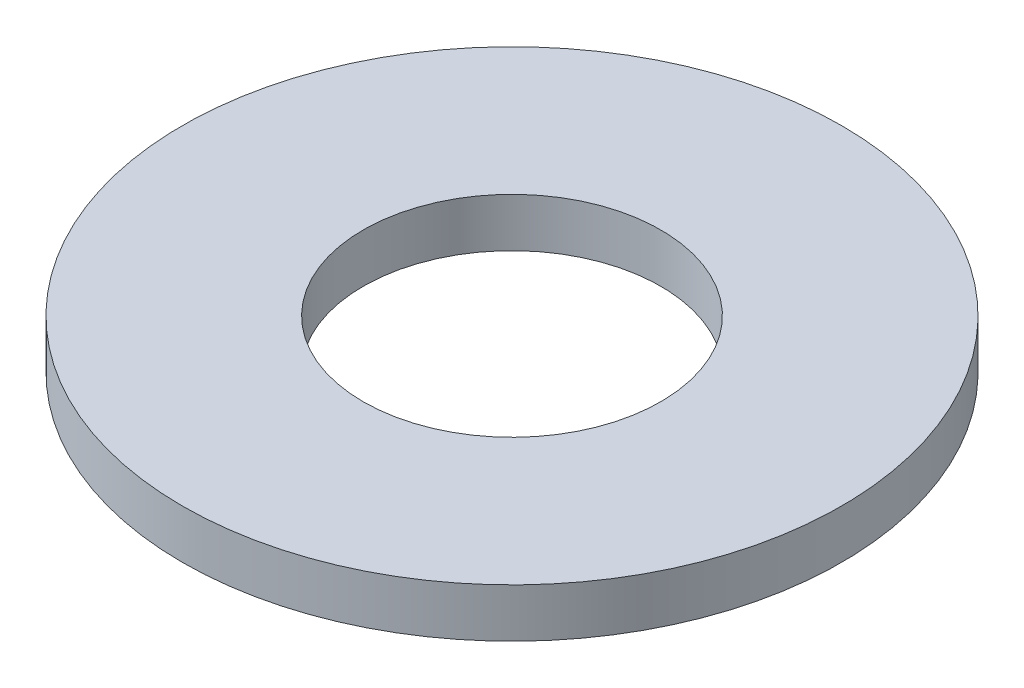
from build123d import *

# Parameters (mm, degrees)
SKETCH1_R           = 3.375
SKETCH1_R_2         = 1.524
BOSS_EXTRUDE1_DEPTH = 0.5


with BuildPart() as part:
    # Sketch1 → Boss-Extrude1 (new body)
    with BuildSketch(Plane(origin=(0, 0, 0), x_dir=(1, 0, 0), z_dir=(0, 1, 0))):
        with Locations(Location((0, 0, 0), (0, 0, 270))):
            Circle(SKETCH1_R)
        with Locations(Location((0, 0, 0), (0, 0, 270))):
            Circle(SKETCH1_R_2, mode=Mode.SUBTRACT)
    extrude(amount=BOSS_EXTRUDE1_DEPTH)


solid = part.part
